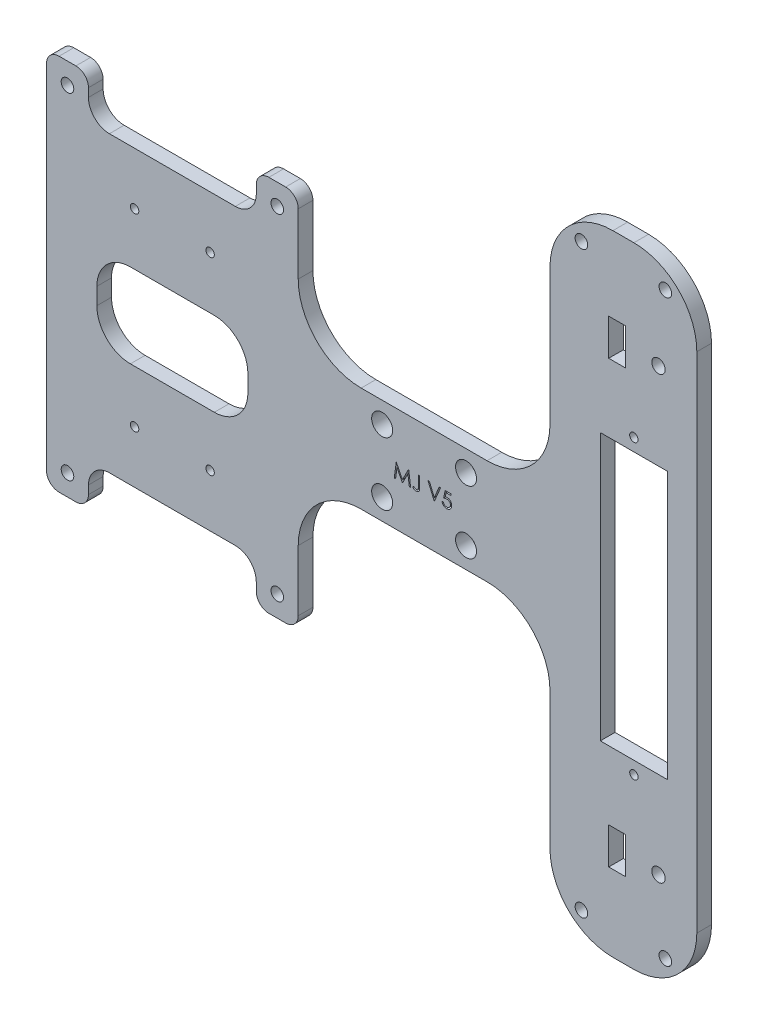
from build123d import *

# Parameters (mm, degrees)
RESSALTO_EXTRUS_O1_DEPTH = 3.5
FILETE1_R                = 15
FILETE2_R                = 5
ESBO_O2_R                = 1
ESBO_O2_R_2              = 1.5
CORTE_EXTRUS_O1_DEPTH    = 12.42
CORTE_EXTRUS_O2_DEPTH    = 3.5
ESBO_O5_R                = 1.6
ESBO_O5_R_2              = 1
ESBO_O5_W                = 4
ESBO_O5_H                = 8.7
ESBO_O5_W_2              = 16
ESBO_O5_H_2              = 63.64
CORTE_EXTRUS_O3_DEPTH    = 3.5
ESBO_O6_R                = 1.5
CORTE_EXTRUS_O4_DEPTH    = 3.5
ESBO_O7_R                = 2.5
CORTE_EXTRUS_O5_DEPTH    = 7
CORTE_EXTRUS_O6_DEPTH    = 7


with BuildPart() as part:
    # Esboço1 → Ressalto-extrusão1 (new body)
    with BuildSketch(Plane.XY):
        with BuildLine():
            Line((-54.953782132, 26.58102253), (-14.953782132, 26.58102253))
            Line((-14.953782132, 26.58102253), (-14.953782132, 33.58102253))
            ThreePointArc((-14.953782132, 33.58102253), (-14.075102475, 35.702342874), (-11.953782132, 36.58102253))
            Line((-11.953782132, 36.58102253), (-7.953782132, 36.58102253))
            ThreePointArc((-7.953782132, 36.58102253), (-5.832461788, 35.702342874), (-4.953782132, 33.58102253))
            Line((-4.953782132, 33.58102253), (-4.953782132, 26.58102253))
            Line((-4.953782132, 26.58102253), (-4.953782132, 4.08102253))
            Line((-4.953782132, 4.08102253), (55.046217868, 4.08102253))
            Line((55.046217868, 4.08102253), (55.046217868, 66.57602253))
            Line((55.046217868, 66.57602253), (90.046217868, 66.57602253))
            Line((90.046217868, 66.57602253), (90.046217868, -83.42397747))
            Line((90.046217868, -83.42397747), (55.046217868, -83.42397747))
            Line((55.046217868, -83.42397747), (55.046217868, -20.91897747))
            Line((55.046217868, -20.91897747), (-4.953782132, -20.91897747))
            Line((-4.953782132, -20.91897747), (-4.953782132, -43.41897747))
            Line((-4.953782132, -43.41897747), (-4.953782132, -50.41897747))
            ThreePointArc((-4.953782132, -50.41897747), (-5.832461788, -52.540297813), (-7.953782132, -53.41897747))
            Line((-7.953782132, -53.41897747), (-11.953782132, -53.41897747))
            ThreePointArc((-11.953782132, -53.41897747), (-14.075102475, -52.540297813), (-14.953782132, -50.41897747))
            Line((-14.953782132, -50.41897747), (-14.953782132, -43.41897747))
            Line((-14.953782132, -43.41897747), (-54.953782132, -43.41897747))
            Line((-54.953782132, -43.41897747), (-54.953782132, -50.41897747))
            ThreePointArc((-54.953782132, -50.41897747), (-55.832461788, -52.540297813), (-57.953782132, -53.41897747))
            Line((-57.953782132, -53.41897747), (-61.953782132, -53.41897747))
            ThreePointArc((-61.953782132, -53.41897747), (-64.075102475, -52.540297813), (-64.953782132, -50.41897747))
            Line((-64.953782132, -50.41897747), (-64.953782132, -43.41897747))
            Line((-64.953782132, -43.41897747), (-64.953782132, 26.58102253))
            Line((-64.953782132, 26.58102253), (-64.953782132, 33.58102253))
            ThreePointArc((-64.953782132, 33.58102253), (-64.075102475, 35.702342874), (-61.953782132, 36.58102253))
            Line((-61.953782132, 36.58102253), (-57.953782132, 36.58102253))
            ThreePointArc((-57.953782132, 36.58102253), (-55.832461788, 35.702342874), (-54.953782132, 33.58102253))
            Line((-54.953782132, 33.58102253), (-54.953782132, 26.58102253))
        make_face()
    extrude(amount=RESSALTO_EXTRUS_O1_DEPTH)

    # Filete1
    filete1_edges = [part.edges().sort_by_distance(p)[0] for p in [
        (-4.953782132, -20.91897747, 1.75),
        (55.046217868, -20.91897747, 1.75),
        (55.046217868, -83.42397747, 1.75),
        (90.046217868, -83.42397747, 1.75),
        (90.046217868, 66.57602253, 1.75),
        (55.046217868, 66.57602253, 1.75),
        (55.046217868, 4.08102253, 1.75),
        (-4.953782132, 4.08102253, 1.75),
    ]]
    fillet(filete1_edges, radius=FILETE1_R)

    # Filete2
    filete2_edges = [part.edges().sort_by_distance(p)[0] for p in [
        (-14.953782132, 26.58102253, 1.75),
        (-54.953782132, 26.58102253, 1.75),
        (-54.953782132, -43.41897747, 1.75),
        (-14.953782132, -43.41897747, 1.75),
    ]]
    fillet(filete2_edges, radius=FILETE2_R)

    # Esboço2 → Corte-extrusão1 (cut)
    with BuildSketch(Plane.XY.offset(3.5)):
        with Locations((-25.953782132, -30.91897747)):
            Circle(ESBO_O2_R)
        with Locations((-43.953782132, -30.91897747)):
            Circle(ESBO_O2_R)
        with Locations(Location((-59.953782132, 31.58102253, 0), (0, 0, 180))):
            Circle(ESBO_O2_R_2)
        with Locations(Location((-9.953782132, 31.58102253, 0), (0, 0, 180))):
            Circle(ESBO_O2_R_2)
        with Locations((-9.953782132, -48.41897747)):
            Circle(ESBO_O2_R_2)
        with Locations((-59.953782132, -48.41897747)):
            Circle(ESBO_O2_R_2)
        with Locations(Location((-43.953782132, 14.08102253, 0), (0, 0, 180))):
            Circle(ESBO_O2_R)
        with Locations(Location((-25.953782132, 14.08102253, 0), (0, 0, 180))):
            Circle(ESBO_O2_R)
    extrude(amount=-CORTE_EXTRUS_O1_DEPTH, mode=Mode.SUBTRACT)

    # Esboço3 → Corte-extrusão2 (cut)
    with BuildSketch(Plane.XY.offset(3.5)):
        with BuildLine():
            Line((-24.953782132, -18.41897747), (-44.953782132, -18.41897747))
            ThreePointArc((-44.953782132, -18.41897747), (-50.610636381, -16.075831719), (-52.953782132, -10.41897747))
            Line((-52.953782132, -10.41897747), (-52.953782132, -6.41897747))
            ThreePointArc((-52.953782132, -6.41897747), (-50.610636381, -0.76212322), (-44.953782132, 1.58102253))
            Line((-44.953782132, 1.58102253), (-24.953782132, 1.58102253))
            ThreePointArc((-24.953782132, 1.58102253), (-19.296927882, -0.76212322), (-16.953782132, -6.41897747))
            Line((-16.953782132, -6.41897747), (-16.953782132, -10.41897747))
            ThreePointArc((-16.953782132, -10.41897747), (-19.296927882, -16.075831719), (-24.953782132, -18.41897747))
        make_face()
    extrude(amount=-CORTE_EXTRUS_O2_DEPTH, mode=Mode.SUBTRACT)

    # Esboço5 → Corte-extrusão3 (cut)
    with BuildSketch(Plane.XY.offset(3.5)):
        with Locations((80.906217868, 44.07602253)):
            Circle(ESBO_O5_R)
        with Locations((80.906217868, -60.92397747)):
            Circle(ESBO_O5_R)
        with Locations((75.046217868, 26.39602253)):
            Circle(ESBO_O5_R_2)
        with Locations((75.046217868, -43.24397747)):
            Circle(ESBO_O5_R_2)
        with Locations((71.046217868, 44.07602253)):
            Rectangle(ESBO_O5_W, ESBO_O5_H)
        with Locations((71.046217868, -60.92397747)):
            Rectangle(ESBO_O5_W, ESBO_O5_H)
        with Locations((75.046217868, -8.42397747)):
            Rectangle(ESBO_O5_W_2, ESBO_O5_H_2)
    extrude(amount=-CORTE_EXTRUS_O3_DEPTH, mode=Mode.SUBTRACT)

    # Esboço6 → Corte-extrusão4 (cut)
    with BuildSketch(Plane.XY.offset(3.5)):
        with Locations((82.546217868, 60.57602253)):
            Circle(ESBO_O6_R)
        with Locations((62.546217868, 60.57602253)):
            Circle(ESBO_O6_R)
        with Locations(Location((62.546217868, -77.42397747, 0), (0, 0, 180))):
            Circle(ESBO_O6_R)
        with Locations(Location((82.546217868, -77.42397747, 0), (0, 0, 180))):
            Circle(ESBO_O6_R)
    extrude(amount=-CORTE_EXTRUS_O4_DEPTH, mode=Mode.SUBTRACT)

    # Esboço7 → Corte-extrusão5 (cut)
    with BuildSketch(Plane.XY.offset(3.5)):
        with Locations((35.046217868, -0.91897747)):
            Circle(ESBO_O7_R)
        with Locations((35.046217868, -15.91897747)):
            Circle(ESBO_O7_R)
        with Locations((15.046217868, -0.91897747)):
            Circle(ESBO_O7_R)
        with Locations((15.046217868, -15.91897747)):
            Circle(ESBO_O7_R)
    extrude(amount=-CORTE_EXTRUS_O5_DEPTH, mode=Mode.SUBTRACT)

    # Esboço8 → Corte-extrusão6 (cut)
    with BuildSketch(Plane.XY.offset(3.5)):
        Polygon((17.936794643, -10.552905556), (18.398833906, -7.052905556), (18.443705701, -7.052905556), (19.88871772, -9.924700428), (21.33022413, -7.052905556), (21.375797047, -7.052905556), (21.840640797, -10.552905556), (21.525135989, -10.552905556), (21.189999771, -8.034476069), (19.926578297, -10.552905556), (19.855764996, -10.552905556), (18.587435669, -8.028867094), (18.253000573, -10.552905556), align=None)
        with BuildLine():
            Line((23.680384387, -7.052905556), (23.994486951, -7.052905556))
            Line((23.994486951, -7.052905556), (23.994486951, -9.416387126))
            add(Edge.make_bspline(
                [(23.994486951, -9.416387126), (23.994173032, -9.460092297), (23.99357027, -9.544011558), (23.99025586, -9.664885454), (23.984122382, -9.77525614), (23.975187369, -9.875374587), (23.963267136, -9.964927143), (23.949626108, -10.044605761), (23.93311331, -10.113745443), (23.908246843, -10.191380799), (23.867472895, -10.276524603), (23.806105857, -10.368479754), (23.72987306, -10.448913165), (23.641572027, -10.518765889), (23.540431003, -10.574423121), (23.428532784, -10.614378299), (23.306566196, -10.638749156), (23.221966984, -10.641323061), (23.178381182, -10.642649145)],
                knots=[0, 0, 0, 0, 1.237770943, 2.376671248, 3.424123796, 4.367912054, 5.222547132, 5.982086412, 6.656319012, 7.234008312, 8.288027371, 9.317870876, 10.352700517, 11.413286737, 12.494591526, 13.606319346, 14.766767577, 16, 16, 16, 16], degree=3))
            add(Edge.make_bspline(
                [(23.178381182, -10.642649145), (23.144422823, -10.641568536), (23.076096357, -10.639394279), (22.974405649, -10.621672566), (22.873003673, -10.594356523), (22.771352224, -10.554353927), (22.667442983, -10.499948329), (22.559868636, -10.428763512), (22.447245445, -10.340931986), (22.373062159, -10.27389424), (22.334230541, -10.238802992)],
                knots=[0, 0, 0, 0, 0.848567217, 1.707373443, 2.573483905, 3.470863513, 4.432650262, 5.500696352, 6.691726801, 8, 8, 8, 8], degree=3))
            Line((22.334230541, -10.238802992), (22.519326695, -9.969572222))
            add(Edge.make_bspline(
                [(22.519326695, -9.969572222), (22.562029374, -9.999019619), (22.6426576, -10.054620142), (22.761162041, -10.126146743), (22.866159194, -10.187471908), (22.934842141, -10.218724187), (22.9666424, -10.233194017)],
                knots=[0, 0, 0, 0, 1.196737151, 2.259595785, 3.194191475, 4, 4, 4, 4], degree=3))
            add(Edge.make_bspline(
                [(22.9666424, -10.233194017), (22.985926711, -10.240753475), (23.02374754, -10.255579254), (23.08157262, -10.272125152), (23.139067657, -10.281167562), (23.177185351, -10.282848895), (23.195909227, -10.283674786)],
                knots=[0, 0, 0, 0, 1.051806502, 2.062826769, 3.048436908, 4, 4, 4, 4], degree=3))
            add(Edge.make_bspline(
                [(23.195909227, -10.283674786), (23.220092015, -10.282652052), (23.267892471, -10.280630482), (23.337356465, -10.262781206), (23.403814496, -10.235536803), (23.464884154, -10.19564551), (23.521169541, -10.148214089), (23.567612367, -10.09085808), (23.606329611, -10.027292096), (23.629629305, -9.967120642), (23.644474077, -9.912244012), (23.653895704, -9.861810876), (23.662134364, -9.802849398), (23.669315916, -9.735289197), (23.673520386, -9.658995015), (23.678237659, -9.574190872), (23.67994292, -9.48066296), (23.680232741, -9.415452008), (23.680384387, -9.381331036)],
                knots=[0, 0, 0, 0, 0.997221856, 1.971139923, 2.944579524, 3.951425367, 4.971190333, 5.972282193, 6.985401279, 8.033996657, 8.624075553, 9.332086008, 10.151144245, 11.082816738, 12.137127781, 13.306538797, 14.590673636, 16, 16, 16, 16], degree=3))
            Line((23.680384387, -9.381331036), (23.680384387, -7.052905556))
        make_face()
        Polygon((25.968845925, -7.052905556), (26.305384387, -7.052905556), (27.472051053, -9.811118697), (28.63871772, -7.052905556), (28.975256182, -7.052905556), (27.494486951, -10.552905556), (27.449615156, -10.552905556), align=None)
        with BuildLine():
            Line((31.488076695, -7.052905556), (31.488076695, -7.411879915))
            Line((31.488076695, -7.411879915), (30.297571887, -7.411879915))
            Line((30.297571887, -7.411879915), (30.108970124, -8.332452831))
            add(Edge.make_bspline(
                [(30.108970124, -8.332452831), (30.146025998, -8.32222256), (30.217815894, -8.302403026), (30.323775755, -8.280397256), (30.424367959, -8.267131811), (30.489643329, -8.265320501), (30.521229739, -8.264444017)],
                knots=[0, 0, 0, 0, 1.100273476, 2.13160584, 3.095893838, 4, 4, 4, 4], degree=3))
            add(Edge.make_bspline(
                [(30.521229739, -8.264444017), (30.560313479, -8.265289953), (30.637161876, -8.266953274), (30.749600823, -8.282925123), (30.856933717, -8.308065038), (30.958936087, -8.34318556), (31.055796637, -8.388095293), (31.146624199, -8.444195233), (31.232782112, -8.509728564), (31.312724706, -8.585073576), (31.385249014, -8.667995193), (31.449015004, -8.757153064), (31.503177594, -8.851680726), (31.546738349, -8.952481335), (31.581522683, -9.058440488), (31.604674678, -9.170673071), (31.620091387, -9.288121191), (31.621813773, -9.368425761), (31.622692079, -9.409375908)],
                knots=[0, 0, 0, 0, 1.052922333, 2.070308379, 3.05430497, 4.020497103, 4.973039431, 5.925935799, 6.892292201, 7.88610001, 8.88166317, 9.857072816, 10.836096531, 11.812156883, 12.81219415, 13.836441305, 14.89672472, 16, 16, 16, 16], degree=3))
            add(Edge.make_bspline(
                [(31.622692079, -9.409375908), (31.622027004, -9.437898129), (31.620705841, -9.494557116), (31.613987254, -9.578701317), (31.601051538, -9.66106415), (31.583683813, -9.741656542), (31.561141395, -9.820325914), (31.533852342, -9.897297442), (31.500456314, -9.972092049), (31.463824939, -10.045417444), (31.422578461, -10.115615951), (31.376799953, -10.181264937), (31.328434462, -10.243349219), (31.276393077, -10.301202952), (31.220192082, -10.35444597), (31.160512115, -10.403394251), (31.097829396, -10.448875582), (31.031174153, -10.489043777), (30.96203167, -10.526006733), (30.889403453, -10.55633027), (30.814942753, -10.583440798), (30.737577877, -10.605050326), (30.657484065, -10.62198288), (30.574529289, -10.633483481), (30.489148619, -10.641859919), (30.431273607, -10.642384276), (30.402039034, -10.642649145)],
                knots=[0, 0, 0, 0, 1.056347294, 2.098418968, 3.122841568, 4.141288669, 5.149314143, 6.15115421, 7.162517403, 8.180376062, 9.185164535, 10.17417709, 11.141909838, 12.097768115, 13.052685741, 14.0056014, 14.954263652, 15.917497458, 16.885230207, 17.854509472, 18.828990115, 19.81800267, 20.826176721, 21.857883937, 22.917946725, 24, 24, 24, 24], degree=3))
            add(Edge.make_bspline(
                [(30.402039034, -10.642649145), (30.367164854, -10.641958307), (30.298554023, -10.640599165), (30.198033456, -10.62638068), (30.10131885, -10.606016764), (30.009188749, -10.575380494), (29.920817485, -10.536993199), (29.837394767, -10.488477028), (29.756788991, -10.433497924), (29.682276955, -10.368617571), (29.613120841, -10.297701889), (29.551214332, -10.220744248), (29.496080756, -10.139014806), (29.448603009, -10.052116652), (29.408104987, -9.960278121), (29.376289999, -9.86315512), (29.350611644, -9.761255116), (29.339748224, -9.691101605), (29.334230541, -9.655469658)],
                knots=[0, 0, 0, 0, 1.0467383, 2.05933395, 3.04377827, 4.011590433, 4.970194871, 5.932262533, 6.905835911, 7.896367577, 8.894135286, 9.877477877, 10.858688626, 11.851381753, 12.8477658, 13.868841284, 14.917554742, 16, 16, 16, 16], degree=3))
            Line((29.334230541, -9.655469658), (29.648333105, -9.655469658))
            add(Edge.make_bspline(
                [(29.648333105, -9.655469658), (29.656061662, -9.688846111), (29.670916379, -9.752997506), (29.703522127, -9.843128847), (29.743388003, -9.923448071), (29.790792351, -9.995017654), (29.847342382, -10.057426651), (29.911871811, -10.113043713), (29.984219534, -10.163218842), (30.064612763, -10.20504161), (30.149425843, -10.240710363), (30.238193053, -10.264462058), (30.328497399, -10.281162951), (30.389575769, -10.282834712), (30.420268201, -10.283674786)],
                knots=[0, 0, 0, 0, 1.136247022, 2.183929868, 3.172523383, 4.106158343, 5.02341133, 5.958108904, 6.928429099, 7.938127109, 8.96079061, 9.975095812, 10.982467395, 12, 12, 12, 12], degree=3))
            add(Edge.make_bspline(
                [(30.420268201, -10.283674786), (30.450226645, -10.282854009), (30.509215068, -10.28123789), (30.596026454, -10.268798878), (30.679839328, -10.249641307), (30.759826685, -10.220971452), (30.837388225, -10.186126733), (30.910561995, -10.141411658), (30.981464872, -10.089951639), (31.047893006, -10.030995009), (31.108732455, -9.966025314), (31.162488576, -9.896547921), (31.20726549, -9.822431074), (31.244999599, -9.744957922), (31.273652897, -9.663279364), (31.294093879, -9.577778189), (31.306096937, -9.488243209), (31.307748117, -9.427173899), (31.308589515, -9.396054594)],
                knots=[0, 0, 0, 0, 1.027316725, 2.022795036, 3.002884548, 3.971462791, 4.93288096, 5.914575861, 6.907176829, 7.935150275, 8.956128384, 9.956726525, 10.942570165, 11.921478529, 12.907843606, 13.90538589, 14.932640048, 16, 16, 16, 16], degree=3))
            add(Edge.make_bspline(
                [(31.308589515, -9.396054594), (31.307931036, -9.367978843), (31.306642156, -9.313024554), (31.296111585, -9.232625347), (31.277794613, -9.156552305), (31.252370733, -9.084438071), (31.220091225, -9.016214628), (31.180644913, -8.951811568), (31.133291515, -8.892077735), (31.079199627, -8.836985181), (31.019941586, -8.786140307), (30.954497843, -8.74279622), (30.884237916, -8.706332302), (30.810008317, -8.674864304), (30.730043418, -8.652263559), (30.645926786, -8.635295673), (30.556750078, -8.625480311), (30.49577939, -8.624118422), (30.464438874, -8.623418376)],
                knots=[0, 0, 0, 0, 1.045622112, 2.046656509, 3.013763289, 3.955457236, 4.890082067, 5.820317437, 6.762574623, 7.722996705, 8.69280354, 9.665887285, 10.63943826, 11.638615906, 12.663482002, 13.728887084, 14.832589034, 16, 16, 16, 16], degree=3))
            add(Edge.make_bspline(
                [(30.464438874, -8.623418376), (30.437309945, -8.623998967), (30.38129559, -8.625197741), (30.295372763, -8.634024238), (30.20508104, -8.648263532), (30.110766545, -8.66784978), (30.012146037, -8.693480856), (29.909427636, -8.724195357), (29.802395369, -8.760917356), (29.730277645, -8.788649569), (29.6932049, -8.802905556)],
                knots=[0, 0, 0, 0, 0.817624296, 1.688186739, 2.600797293, 3.572016777, 4.590301741, 5.671205678, 6.80286297, 8, 8, 8, 8], degree=3))
            Line((29.6932049, -8.802905556), (30.052179259, -7.052905556))
            Line((30.052179259, -7.052905556), (31.488076695, -7.052905556))
        make_face()
    extrude(amount=-CORTE_EXTRUS_O6_DEPTH, mode=Mode.SUBTRACT)


solid = part.part
